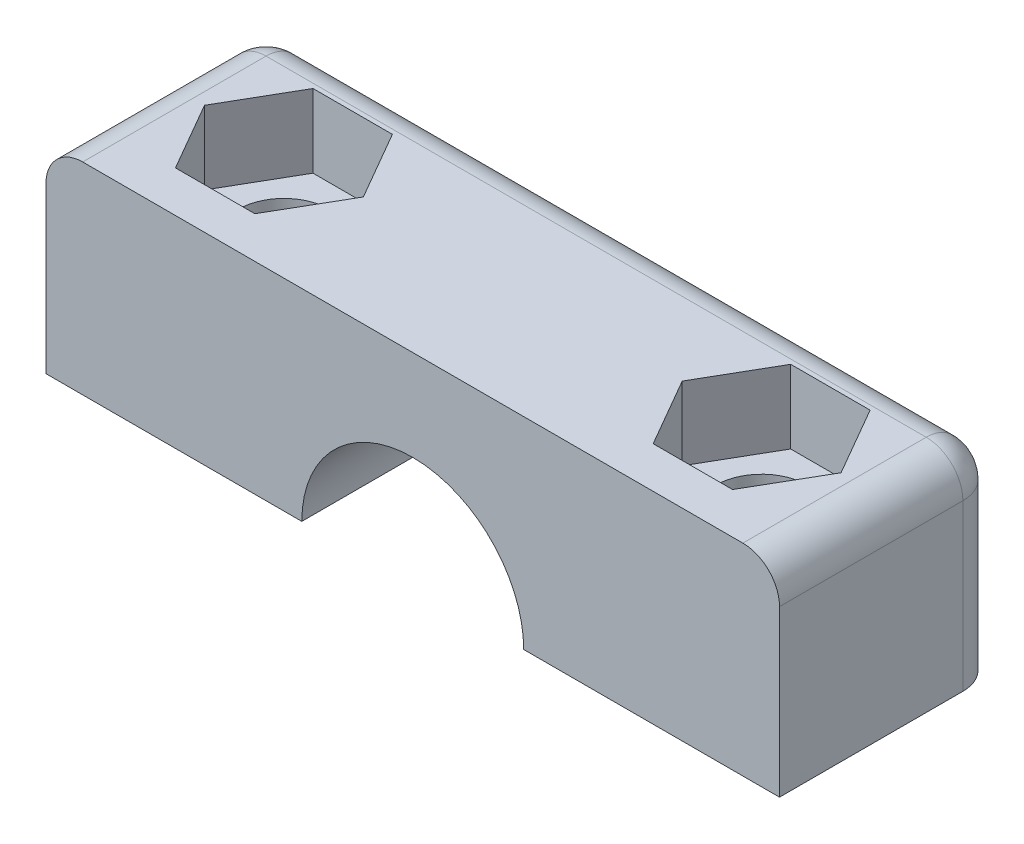
from build123d import *

# Parameters (mm, degrees)
ESQUISSE1_W             = 40
ESQUISSE1_H             = 18
BOSS_EXTRU_1_DEPTH      = 12
ESQUISSE2_W             = 40
ESQUISSE2_H             = 12
BOSS_EXTRU_2_DEPTH      = 10
ENL_V_MAT_EXTRU_1_DEPTH = 12
ESQUISSE4_R             = 2.5
ENL_V_MAT_EXTRU_2_DEPTH = 28
ESQUISSE5_R             = 2.5
ENL_V_MAT_EXTRU_3_DEPTH = 12
ESQUISSE7_R             = 3.5
ENL_V_MAT_EXTRU_4_DEPTH = 4
ESQUISSE6_R             = 3.5
ENL_V_MAT_EXTRU_5_DEPTH = 12
CONG_1_R                = 2
ESQUISSE8_W             = 63.620200945
ESQUISSE8_H             = 32.659215008
ENL_V_MAT_EXTRU_6_DEPTH = 12
CONG_3_R                = 2
ENL_V_MAT_EXTRU_7_DEPTH = 4


with BuildPart() as part:
    # Esquisse1 → Boss.-Extru.1 (new body)
    with BuildSketch(Plane.XY):
        with Locations((3.185612757, 0.725848564)):
            Rectangle(ESQUISSE1_W, ESQUISSE1_H)
    extrude(amount=BOSS_EXTRU_1_DEPTH)

    # Esquisse2 → Boss.-Extru.2 (add)
    with BuildSketch(Plane.XZ.offset(8.274151436)):
        with Locations((3.185612757, 6)):
            Rectangle(ESQUISSE2_W, ESQUISSE2_H)
    extrude(amount=BOSS_EXTRU_2_DEPTH)

    # Esquisse3 → Enlèv. mat.-Extru.1 (cut)
    with BuildSketch(Plane.XY.offset(12)):
        with BuildLine():
            Line((-2.864387243, -18.274151436), (9.235612757, -18.274151436))
            ThreePointArc((9.235612757, -18.274151436), (3.185612757, -12.224151436), (-2.864387243, -18.274151436))
        make_face()
    extrude(amount=-ENL_V_MAT_EXTRU_1_DEPTH, mode=Mode.SUBTRACT)

    # Esquisse4 → Enlèv. mat.-Extru.2 (cut)
    with BuildSketch(Plane.XZ.offset(18.274151436)):
        with Locations(Location((-9.839387243, 6, 0), (0, 0, 270))):
            Circle(ESQUISSE4_R)
        with Locations(Location((16.210612757, 6, 0), (0, 0, 270))):
            Circle(ESQUISSE4_R)
    extrude(amount=-ENL_V_MAT_EXTRU_2_DEPTH, mode=Mode.SUBTRACT)

    # Esquisse5 → Enlèv. mat.-Extru.3 (cut)
    with BuildSketch(Plane.XY.offset(12)):
        with Locations((9.185612757, 0.725848564)):
            Circle(ESQUISSE5_R)
        with Locations((-2.814387243, 0.725848564)):
            Circle(ESQUISSE5_R)
    extrude(amount=-ENL_V_MAT_EXTRU_3_DEPTH, mode=Mode.SUBTRACT)

    # Esquisse7 → Enlèv. mat.-Extru.4 (cut)
    with BuildSketch(Plane(origin=(0, 0, 0), x_dir=(-1, 0, 0), z_dir=(0, 0, -1))):
        with Locations((-9.185612757, 0.725848564)):
            Circle(ESQUISSE7_R)
        with Locations((2.814387243, 0.725848564)):
            Circle(ESQUISSE7_R)
    extrude(amount=-ENL_V_MAT_EXTRU_4_DEPTH, mode=Mode.SUBTRACT)

    # Esquisse6 → Enlèv. mat.-Extru.5 (cut)
    with BuildSketch(Plane(origin=(0, 9.725848564, 0), x_dir=(1, 0, 0), z_dir=(0, 1, 0))):
        with Locations(Location((16.210612757, -6, 0), (0, 0, 270))):
            Circle(ESQUISSE6_R)
        with Locations(Location((-9.839387243, -6, 0), (0, 0, 270))):
            Circle(ESQUISSE6_R)
    extrude(amount=-ENL_V_MAT_EXTRU_5_DEPTH, mode=Mode.SUBTRACT)

    # Congé1
    cong_1_edges = [part.edges().sort_by_distance(p)[0] for p in [
        (3.185612757, 9.725848564, 0),
        (23.185612757, -4.274151436, 0),
        (-16.814387243, -4.274151436, 0),
        (-16.814387243, 9.725848564, 6),
        (23.185612757, 9.725848564, 6),
    ]]
    fillet(cong_1_edges, radius=CONG_1_R)

    # Esquisse8 → Enlèv. mat.-Extru.6 (cut)
    with BuildSketch(Plane(origin=(0, 0, 0), x_dir=(-1, 0, 0), z_dir=(0, 0, -1))):
        with Locations((-6.809355957, 9.055456068)):
            Rectangle(ESQUISSE8_W, ESQUISSE8_H)
    extrude(amount=-ENL_V_MAT_EXTRU_6_DEPTH, mode=Mode.SUBTRACT)

    # Congé3
    cong_3_edges = [part.edges().sort_by_distance(p)[0] for p in [
        (-16.228600805, -7.274151436, 0.585786438),
        (23.185612757, -7.274151436, 7),
        (-16.814387243, -7.274151436, 7),
        (22.59982632, -7.274151436, 0.585786438),
        (3.185612757, -7.274151436, 0),
    ]]
    fillet(cong_3_edges, radius=CONG_3_R)

    # Esquisse9 → Enlèv. mat.-Extru.7 (cut)
    with BuildSketch(Plane(origin=(0, -7.274151436, 0), x_dir=(1, 0, 0), z_dir=(0, 1, 0))):
        Polygon((-5.509260224, -6), (-7.674323733, -2.25), (-12.004450752, -2.25), (-14.169514261, -6), (-12.004450752, -9.75), (-7.674323733, -9.75), align=None)
        Polygon((11.880485739, -6), (14.045549248, -9.75), (18.375676267, -9.75), (20.540739776, -6), (18.375676267, -2.25), (14.045549248, -2.25), align=None)
    extrude(amount=-ENL_V_MAT_EXTRU_7_DEPTH, mode=Mode.SUBTRACT)


solid = part.part
